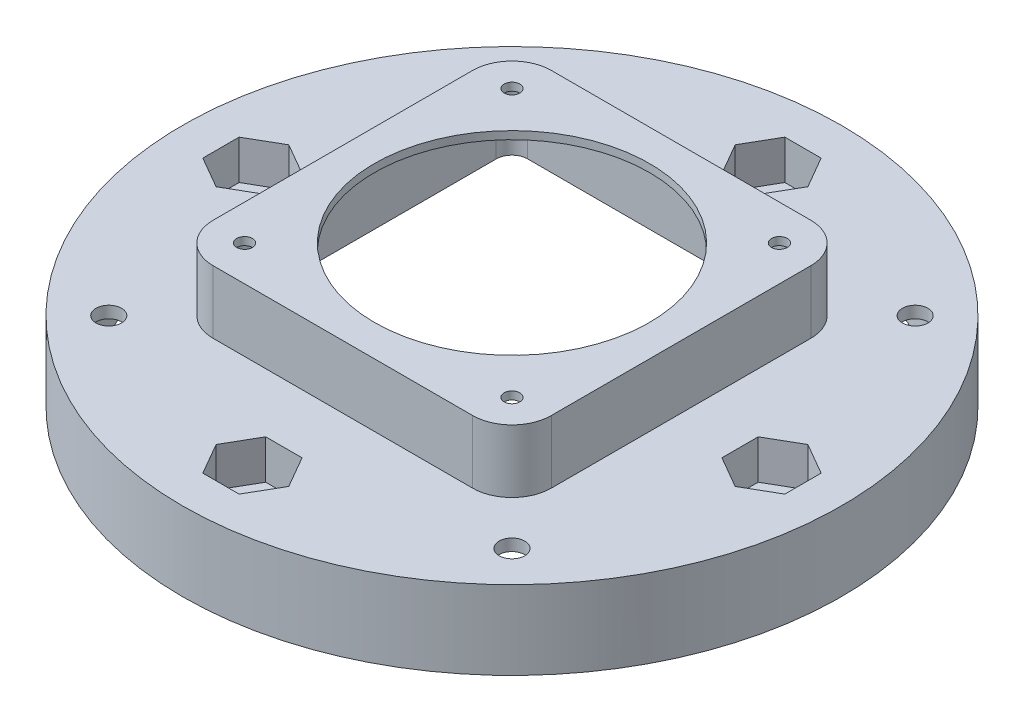
from build123d import *

# Parameters (mm, degrees)
SKETCH1_R               = 41.9
TOP_PART_DEPTH          = 15
SKETCH2_R               = 30
CUT_EXTRUDE1_DEPTH      = 20
FILLET1_R               = 1.5
CHAMFER1_SIZE           = 2
SKETCH8_7_R             = 1.625
CUT_EXTRUDE8_DEPTH      = 3
SKETCH8_R               = 1.625
CUT_EXTRUDE7_DEPTH      = 62.124626857
CUT_EXTRUDE11_DEPTH     = 62.124626857
SKETCH15_R              = 1.625
CUT_EXTRUDE14_DEPTH     = 10
CUT_EXTRUDE15_DEPTH     = 10
CIRPATTERN1_COUNT       = 4
CIRPATTERN2_COUNT       = 4
SKETCH3_R               = 41.9
BOTTOM_PART_DEPTH       = 20
SKETCH6_R               = 37.9
CUT_EXTRUDE3_DEPTH      = 63.076324134
SKETCH_1_W              = 43
SKETCH_1_H              = 43
EXTRUDE_1_DEPTH         = 8
FILLET_1_R              = 5
CUT_EXTRUDE4_DEPTH      = 63.076324134
CUT_EXTRUDE4_DEPTH_BACK = 63.076324134
SKETCH7_R               = 17.5
SKETCH7_R_2             = 1
SKETCH12_W              = 39.5
SKETCH12_H              = 39.5
CUT_EXTRUDE10_DEPTH     = 8.5
FILLET3_R               = 2
SKETCH17_R              = 1.625
CUT_EXTRUDE16_DEPTH     = 63.076324134
SKETCH18_R              = 3
CUT_EXTRUDE17_DEPTH     = 63.076324134
SKETCH19_R              = 2.75
BOSS_EXTRUDE1_DEPTH     = 18.5
SKETCH20_W              = 87.79908129
SKETCH20_H              = 93.09964502
CUT_EXTRUDE18_DEPTH     = 10
SKETCH21_W              = 20
SKETCH21_H              = 8.651798588
CUT_EXTRUDE19_DEPTH     = 15
SKETCH22_R              = 41.9
SKETCH22_R_2            = 30
CUT_EXTRUDE20_DEPTH     = 15
SKETCH23_R              = 2.75
CUT_EXTRUDE21_DEPTH     = 62.92915307
CUT_EXTRUDE22_DEPTH     = 5
SKETCH25_R              = 1
CUT_EXTRUDE23_DEPTH     = 10


with BuildPart() as part:
    # Sketch1 → Top-Part (new body)
    with BuildSketch(Plane(origin=(0, 0, 0), x_dir=(1, 0, 0), z_dir=(0, 1, 0))):
        with Locations(Location((0, 0, 0), (0, 0, 270))):
            Circle(SKETCH1_R)
    extrude(amount=TOP_PART_DEPTH)

    # Sketch2 → Cut-Extrude1 (cut)
    with BuildSketch(Plane(origin=(0, 15, 0), x_dir=(1, 0, 0), z_dir=(0, 1, 0))):
        with Locations(Location((0, 0, 0), (0, 0, 270))):
            Circle(SKETCH2_R)
    extrude(amount=-CUT_EXTRUDE1_DEPTH, mode=Mode.SUBTRACT)

    # Fillet1
    fillet1_edges = [part.edges().sort_by_distance(p)[0] for p in [
        (0, 15, -41.9),
    ]]
    fillet(fillet1_edges, radius=FILLET1_R)

    # Chamfer1
    chamfer1_edges = [part.edges().sort_by_distance(p)[0] for p in [
        (0, 15, -30),
    ]]
    chamfer(chamfer1_edges, length=CHAMFER1_SIZE)

    # Sketch8<7> → Cut-Extrude8 (cut)
    # profile 1 of 4: a face of its own
    with BuildSketch(Plane(origin=(0, 15, 0), x_dir=(1, 0, 0), z_dir=(0, 1, 0))):
        Polygon((25.083213555, 22.516777398), (28.056316743, 23.598898462), (28.605724005, 26.714741882), (26.182028081, 28.748464238), (23.208924893, 27.666343174), (22.659517631, 24.550499754), align=None)
        with Locations(Location((25.632620818, 25.632620818, 0), (0, 0, 270))):
            Circle(SKETCH8_7_R, mode=Mode.SUBTRACT)
    # profile 2 of 4: a face of its own
    with BuildSketch(Plane(origin=(0, 15, 0), x_dir=(1, 0, 0), z_dir=(0, 1, 0))):
        Polygon((-22.516777398, 25.083213555), (-23.598898462, 28.056316743), (-26.714741882, 28.605724005), (-28.748464238, 26.182028081), (-27.666343174, 23.208924893), (-24.550499754, 22.659517631), align=None)
        with Locations(Location((-25.632620818, 25.632620818, 0), (0, 0, 270))):
            Circle(SKETCH8_7_R, mode=Mode.SUBTRACT)
    # profile 3 of 4: a face of its own
    with BuildSketch(Plane(origin=(0, 15, 0), x_dir=(1, 0, 0), z_dir=(0, 1, 0))):
        Polygon((22.516777398, -25.083213555), (23.598898462, -28.056316743), (26.714741882, -28.605724005), (28.748464238, -26.182028081), (27.666343174, -23.208924893), (24.550499754, -22.659517631), align=None)
        with Locations(Location((25.632620818, -25.632620818, 0), (0, 0, 270))):
            Circle(SKETCH8_7_R, mode=Mode.SUBTRACT)
    # profile 4 of 4: a face of its own
    with BuildSketch(Plane(origin=(0, 15, 0), x_dir=(1, 0, 0), z_dir=(0, 1, 0))):
        Polygon((-25.083213555, -22.516777398), (-28.056316743, -23.598898462), (-28.605724005, -26.714741882), (-26.182028081, -28.748464238), (-23.208924893, -27.666343174), (-22.659517631, -24.550499754), align=None)
        with Locations(Location((-25.632620818, -25.632620818, 0), (0, 0, 270))):
            Circle(SKETCH8_7_R, mode=Mode.SUBTRACT)
    extrude(amount=-CUT_EXTRUDE8_DEPTH, mode=Mode.SUBTRACT)

    # Sketch8 → Cut-Extrude7 (cut, through all)
    with BuildSketch(Plane(origin=(0, 15, 0), x_dir=(1, 0, 0), z_dir=(0, 1, 0))):
        with Locations(Location((-25.632620818, 25.632620818, 0), (0, 0, 270))):
            Circle(SKETCH8_R)
        with Locations(Location((25.632620818, 25.632620818, 0), (0, 0, 270))):
            Circle(SKETCH8_R)
        with Locations(Location((25.632620818, -25.632620818, 0), (0, 0, 270))):
            Circle(SKETCH8_R)
        with Locations(Location((-25.632620818, -25.632620818, 0), (0, 0, 270))):
            Circle(SKETCH8_R)
    extrude(amount=-CUT_EXTRUDE7_DEPTH, mode=Mode.SUBTRACT)

    # Sketch13 → Cut-Extrude11 (cut, through all)
    with BuildSketch(Plane.XZ):
        with BuildLine():
            Line((-10, 35.519149765), (-10, 40.689187753))
            ThreePointArc((-10, 40.689187753), (0, 41.9), (10, 40.689187753))
            Line((10, 40.689187753), (10, 35.519149765))
            ThreePointArc((10, 35.519149765), (0, 36.9), (-10, 35.519149765))
        make_face()
    extrude(amount=-CUT_EXTRUDE11_DEPTH, mode=Mode.SUBTRACT)

    # Sketch15 → Cut-Extrude14 (cut, symmetric)
    with BuildSketch(Plane.XY.offset(32.4)):
        with Locations(Location((0, 7.5, 0), (0, 0, 180))):
            Circle(SKETCH15_R)
    cut_extrude14 = extrude(amount=CUT_EXTRUDE14_DEPTH, both=True, mode=Mode.SUBTRACT)

    # Sketch16 → Cut-Extrude15 (cut)
    with BuildSketch(Plane.XY.offset(32.4)):
        Polygon((3.377499075, 7.5), (1.688749537, 10.425), (-1.688749537, 10.425), (-3.377499075, 7.5), (-1.688749537, 4.575), (1.688749537, 4.575), align=None)
    cut_extrude15 = extrude(amount=-CUT_EXTRUDE15_DEPTH, mode=Mode.SUBTRACT)

    # CirPattern1: Cut-Extrude14 ×4 about axis
    cirpattern1_axis = Axis((0, 0, 0), (0, 1, 0))
    for i in range(1, CIRPATTERN1_COUNT):
        add(cut_extrude14.rotate(cirpattern1_axis, i * 360 / CIRPATTERN1_COUNT), mode=Mode.SUBTRACT)

    # CirPattern2: Cut-Extrude15 ×4 about axis
    cirpattern2_axis = Axis((0, 0, 0), (0, 1, 0))
    for i in range(1, CIRPATTERN2_COUNT):
        add(cut_extrude15.rotate(cirpattern2_axis, i * 360 / CIRPATTERN2_COUNT), mode=Mode.SUBTRACT)

    # Sketch21 → Cut-Extrude19 (cut)
    with BuildSketch(Plane(origin=(0, 15, 0), x_dir=(1, 0, 0), z_dir=(0, 1, 0))):
        with Locations((0, -39.225899294)):
            Rectangle(SKETCH21_W, SKETCH21_H)
    extrude(amount=-CUT_EXTRUDE19_DEPTH, mode=Mode.SUBTRACT)

    # Sketch22 → Cut-Extrude20 (cut)
    with BuildSketch(Plane(origin=(0, 15, 0), x_dir=(1, 0, 0), z_dir=(0, 1, 0))):
        with Locations(Location((0, 0, 0), (0, 0, 270))):
            Circle(SKETCH22_R)
        Circle(SKETCH22_R_2, mode=Mode.SUBTRACT)
    extrude(amount=-CUT_EXTRUDE20_DEPTH, mode=Mode.SUBTRACT)


with BuildPart() as body_2:
    # Sketch3 → Bottom-Part (new body)
    with BuildSketch(Plane.XZ):
        with Locations(Location((0, 0, 0), (0, 0, 270))):
            Circle(SKETCH3_R)
    extrude(amount=BOTTOM_PART_DEPTH)

    # Sketch6 → Cut-Extrude3 (cut, through all)
    with BuildSketch(Plane(origin=(0, -1.5, 0), x_dir=(1, 0, 0), z_dir=(0, 1, 0))):
        with Locations(Location((0, 0, 0), (0, 0, 270))):
            Circle(SKETCH6_R)
    extrude(amount=-CUT_EXTRUDE3_DEPTH, mode=Mode.SUBTRACT)

    # ｽｹｯﾁ1 → ﾎﾞｽ - 押し出し1 (add)
    with BuildSketch(Plane(origin=(0, 0, 0), x_dir=(1, 0, 0), z_dir=(0, 1, 0))):
        Rectangle(SKETCH_1_W, SKETCH_1_H)
    extrude(amount=EXTRUDE_1_DEPTH)

    # ﾌｨﾚｯﾄ1
    fillet_1_edges = [body_2.edges().sort_by_distance(p)[0] for p in [
        (-21.5, 4, -21.5),
        (-21.5, 4, 21.5),
        (21.5, 4, 21.5),
        (21.5, 4, -21.5),
    ]]
    fillet(fillet_1_edges, radius=FILLET_1_R)

    # Sketch7 → Cut-Extrude4 (cut, two sides: drawn at the far end of the back side and taken through both)
    with BuildSketch(Plane(origin=(0, -1.5, 0), x_dir=(1, 0, 0), z_dir=(0, 1, 0)).offset(-CUT_EXTRUDE4_DEPTH_BACK)):
        with Locations(Location((0, 0, 0), (0, 0, 270))):
            Circle(SKETCH7_R)
        with Locations(Location((17, -17, 0), (0, 0, 270))):
            Circle(SKETCH7_R_2)
        with Locations(Location((-17, -17, 0), (0, 0, 270))):
            Circle(SKETCH7_R_2)
        with Locations(Location((-17, 17, 0), (0, 0, 270))):
            Circle(SKETCH7_R_2)
        with Locations(Location((17, 17, 0), (0, 0, 270))):
            Circle(SKETCH7_R_2)
    extrude(amount=CUT_EXTRUDE4_DEPTH + CUT_EXTRUDE4_DEPTH_BACK, mode=Mode.SUBTRACT)

    # Sketch12 → Cut-Extrude10 (cut)
    with BuildSketch(Plane.XZ.offset(1.5)):
        Rectangle(SKETCH12_W, SKETCH12_H)
    extrude(amount=-CUT_EXTRUDE10_DEPTH, mode=Mode.SUBTRACT)

    # Fillet3
    fillet3_edges = [body_2.edges().sort_by_distance(p)[0] for p in [
        (-19.75, 2.75, -19.75),
        (-19.75, 2.75, 19.75),
        (19.75, 2.75, 19.75),
        (19.75, 2.75, -19.75),
    ]]
    fillet(fillet3_edges, radius=FILLET3_R)

    # Sketch17 → Cut-Extrude16 (cut, through all)
    with BuildSketch(Plane.XZ.offset(1.5)):
        with Locations(Location((25.632620818, -25.632620818, 0), (0, 0, 270))):
            Circle(SKETCH17_R)
        with Locations(Location((-25.632620818, -25.632620818, 0), (0, 0, 270))):
            Circle(SKETCH17_R)
        with Locations(Location((25.632620818, 25.632620818, 0), (0, 0, 270))):
            Circle(SKETCH17_R)
        with Locations(Location((-25.632620818, 25.632620818, 0), (0, 0, 270))):
            Circle(SKETCH17_R)
    extrude(amount=-CUT_EXTRUDE16_DEPTH, mode=Mode.SUBTRACT)

    # Sketch18 → Cut-Extrude17 (cut, through all)
    with BuildSketch(Plane.XZ.offset(1.5)):
        with Locations((-25.632620818, 25.632620818)):
            Circle(SKETCH18_R)
        with Locations((25.632620818, 25.632620818)):
            Circle(SKETCH18_R)
        with Locations((25.632620818, -25.632620818)):
            Circle(SKETCH18_R)
        with Locations((-25.632620818, -25.632620818)):
            Circle(SKETCH18_R)
    extrude(amount=CUT_EXTRUDE17_DEPTH, mode=Mode.SUBTRACT)

    # Sketch19 → Boss-Extrude1 (add)
    # profile 1 of 4: a face of its own
    with BuildSketch(Plane.XZ.offset(1.5)):
        with BuildLine():
            Line((-6, 33), (-6, 37.422052322))
            ThreePointArc((-6, 37.422052322), (0, 37.9), (6, 37.422052322))
            Line((6, 37.422052322), (6, 33))
            ThreePointArc((6, 33), (0, 27), (-6, 33))
        make_face()
        with Locations(Location((0, 33, 0), (0, 0, 270))):
            Circle(SKETCH19_R, mode=Mode.SUBTRACT)
    # profile 2 of 4: a face of its own
    with BuildSketch(Plane.XZ.offset(1.5)):
        with BuildLine():
            Line((33, 6), (37.422052322, 6))
            ThreePointArc((37.422052322, 6), (37.9, 0), (37.422052322, -6))
            Line((37.422052322, -6), (33, -6))
            ThreePointArc((33, -6), (27, 0), (33, 6))
        make_face()
        with Locations(Location((33, 0, 0), (0, 0, 270))):
            Circle(SKETCH19_R, mode=Mode.SUBTRACT)
    # profile 3 of 4: a face of its own
    with BuildSketch(Plane.XZ.offset(1.5)):
        with BuildLine():
            Line((6, -33), (6, -37.422052322))
            ThreePointArc((6, -37.422052322), (0, -37.9), (-6, -37.422052322))
            Line((-6, -37.422052322), (-6, -33))
            ThreePointArc((-6, -33), (0, -27), (6, -33))
        make_face()
        with Locations(Location((0, -33, 0), (0, 0, 270))):
            Circle(SKETCH19_R, mode=Mode.SUBTRACT)
    # profile 4 of 4: a face of its own
    with BuildSketch(Plane.XZ.offset(1.5)):
        with BuildLine():
            Line((-33, -6), (-37.422052322, -6))
            ThreePointArc((-37.422052322, -6), (-37.9, 0), (-37.422052322, 6))
            Line((-37.422052322, 6), (-33, 6))
            ThreePointArc((-33, 6), (-27, 0), (-33, -6))
        make_face()
        with Locations(Location((-33, 0, 0), (0, 0, 270))):
            Circle(SKETCH19_R, mode=Mode.SUBTRACT)
    extrude(amount=BOSS_EXTRUDE1_DEPTH)

    # Sketch20 → Cut-Extrude18 (cut)
    with BuildSketch(Plane.XZ.offset(20)):
        Rectangle(SKETCH20_W, SKETCH20_H)
    extrude(amount=-CUT_EXTRUDE18_DEPTH, mode=Mode.SUBTRACT)

    # Sketch23 → Cut-Extrude21 (cut, through all)
    with BuildSketch(Plane.XZ.offset(10)):
        with Locations(Location((0, 33, 0), (0, 0, 90))):
            Circle(SKETCH23_R)
        with Locations(Location((-33, 0, 0), (0, 0, 90))):
            Circle(SKETCH23_R)
        with Locations(Location((0, -33, 0), (0, 0, 90))):
            Circle(SKETCH23_R)
        with Locations(Location((33, 0, 0), (0, 0, 90))):
            Circle(SKETCH23_R)
    extrude(amount=-CUT_EXTRUDE21_DEPTH, mode=Mode.SUBTRACT)

    # Sketch24 → Cut-Extrude22 (cut)
    with BuildSketch(Plane(origin=(0, 0, 0), x_dir=(1, 0, 0), z_dir=(0, 1, 0))):
        Polygon((37, -2.309401077), (37, 2.309401077), (33, 4.618802154), (29, 2.309401077), (29, -2.309401077), (33, -4.618802154), align=None)
        Polygon((4.618802154, 33), (2.309401077, 37), (-2.309401077, 37), (-4.618802154, 33), (-2.309401077, 29), (2.309401077, 29), align=None)
        Polygon((-2.309401077, -37), (2.309401077, -37), (4.618802154, -33), (2.309401077, -29), (-2.309401077, -29), (-4.618802154, -33), align=None)
        Polygon((-37, 2.309401077), (-37, -2.309401077), (-33, -4.618802154), (-29, -2.309401077), (-29, 2.309401077), (-33, 4.618802154), align=None)
    extrude(amount=-CUT_EXTRUDE22_DEPTH, mode=Mode.SUBTRACT)

    # Sketch25 → Cut-Extrude23 (cut)
    with BuildSketch(Plane(origin=(0, 0, 0), x_dir=(1, 0, 0), z_dir=(0, 1, 0))):
        with Locations(Location((-2, 22.5, 0), (0, 0, 270))):
            Circle(SKETCH25_R)
        with Locations(Location((2, 22.5, 0), (0, 0, 270))):
            Circle(SKETCH25_R)
    extrude(amount=-CUT_EXTRUDE23_DEPTH, mode=Mode.SUBTRACT)


solid = body_2.part
